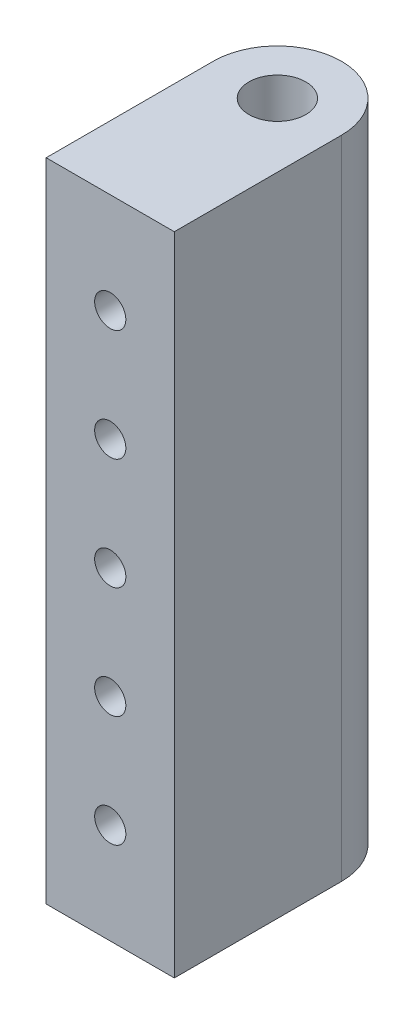
from build123d import *

# Parameters (mm, degrees)
SKETCH1_R           = 2.55
BOSS_EXTRUDE1_DEPTH = 58
SKETCH2_R           = 1.4
CUT_EXTRUDE1_DEPTH  = 10


with BuildPart() as part:
    # Sketch1 → Boss-Extrude1 (new body)
    with BuildSketch(Plane(origin=(0, 0, 0), x_dir=(1, 0, 0), z_dir=(0, 1, 0))):
        with BuildLine():
            Line((-5.75, 0), (-5.75, -15))
            Line((-5.75, -15), (5.75, -15))
            Line((5.75, -15), (5.75, 0))
            ThreePointArc((5.75, 0), (0, 5.75), (-5.75, 0))
        make_face()
        with Locations(Location((0, 0, 0), (0, 0, 90))):
            Circle(SKETCH1_R, mode=Mode.SUBTRACT)
    extrude(amount=BOSS_EXTRUDE1_DEPTH)

    # Sketch2 → Cut-Extrude1 (cut)
    with BuildSketch(Plane.XY.offset(15)):
        with Locations((0, 49)):
            Circle(SKETCH2_R)
        with Locations((0, 39)):
            Circle(SKETCH2_R)
        with Locations((0, 29)):
            Circle(SKETCH2_R)
        with Locations((0, 19)):
            Circle(SKETCH2_R)
        with Locations((0, 9)):
            Circle(SKETCH2_R)
    extrude(amount=-CUT_EXTRUDE1_DEPTH, mode=Mode.SUBTRACT)


solid = part.part
